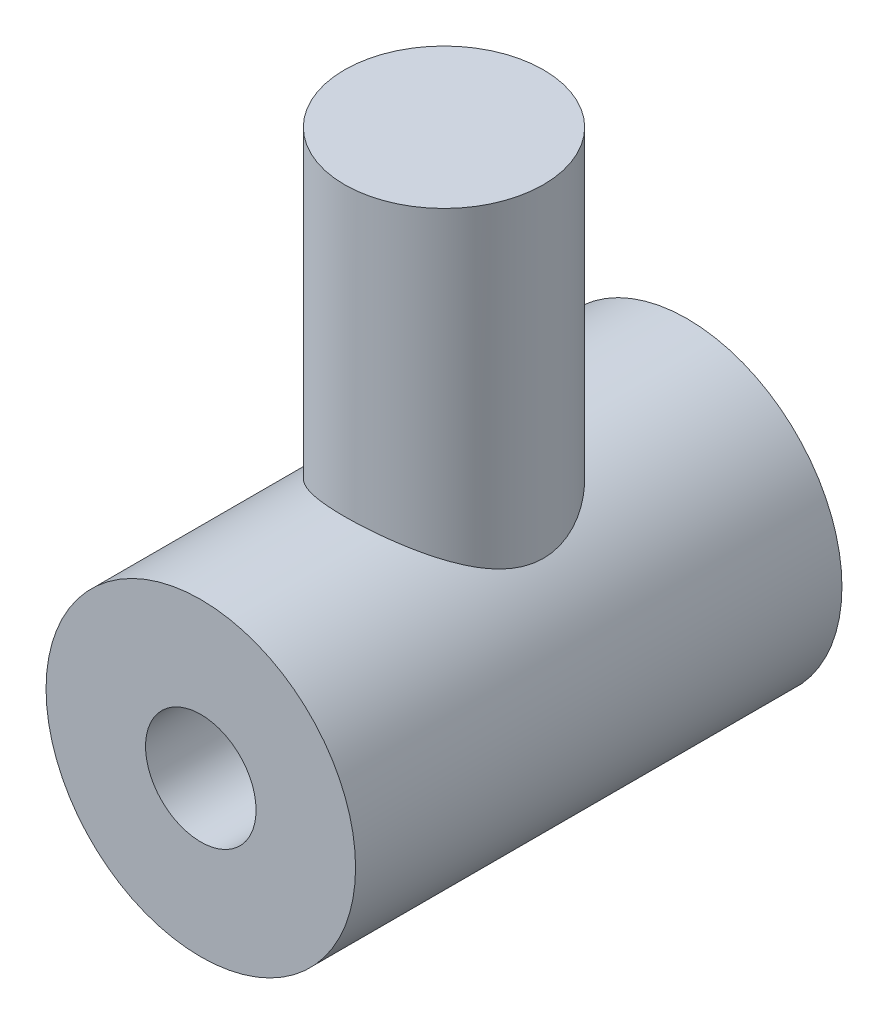
from build123d import *

# Parameters (mm, degrees)
SKETCH1_R           = 14
BOSS_EXTRUDE1_DEPTH = 44
SKETCH2_R           = 9
BOSS_EXTRUDE2_DEPTH = 40
SKETCH3_R           = 5
CUT_EXTRUDE1_DEPTH  = 62.090097558


with BuildPart() as part:
    # Sketch1 → Boss-Extrude1 (new body)
    with BuildSketch(Plane.XY):
        Circle(SKETCH1_R)
    extrude(amount=BOSS_EXTRUDE1_DEPTH)

    # Sketch2 → Boss-Extrude2 (add)
    with BuildSketch(Plane(origin=(0, 0, 0), x_dir=(1, 0, 0), z_dir=(0, 1, 0))):
        with Locations(Location((0, -22, 0), (0, 0, 90))):
            Circle(SKETCH2_R)
    extrude(amount=BOSS_EXTRUDE2_DEPTH)

    # Sketch3 → Cut-Extrude1 (cut, through all)
    with BuildSketch(Plane.XY.offset(44)):
        Circle(SKETCH3_R)
    extrude(amount=-CUT_EXTRUDE1_DEPTH, mode=Mode.SUBTRACT)


solid = part.part
